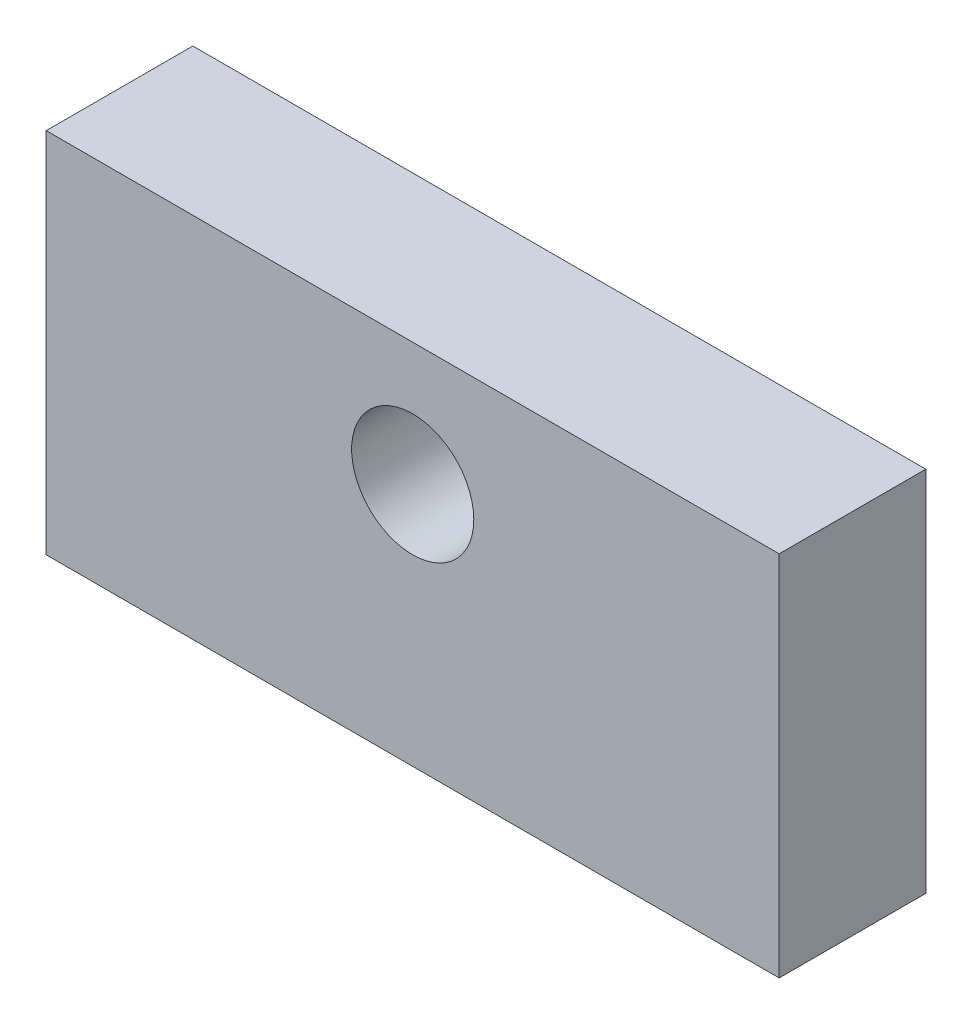
from build123d import *

# Parameters (mm, degrees)
SKETCH_1_W          = 30
SKETCH_1_H          = 15.036334349
EXTRUDE_1_DEPTH     = 6
SKETCH_2_R          = 2.5
CUT_EXTRUDE_2_DEPTH = 4


with BuildPart() as part:
    # Эскиз1 → Вытянуть1 (new body)
    with BuildSketch(Plane.XY):
        with Locations((3.443270242, -3.627864348)):
            Rectangle(SKETCH_1_W, SKETCH_1_H)
    extrude(amount=EXTRUDE_1_DEPTH)

    # Эскиз2 → Вытянуть2 (cut)
    with BuildSketch(Plane.XY.offset(6)):
        with Locations((3.443270242, -1.14603177)):
            Circle(SKETCH_2_R)
    extrude(amount=-CUT_EXTRUDE_2_DEPTH, mode=Mode.SUBTRACT)


solid = part.part
